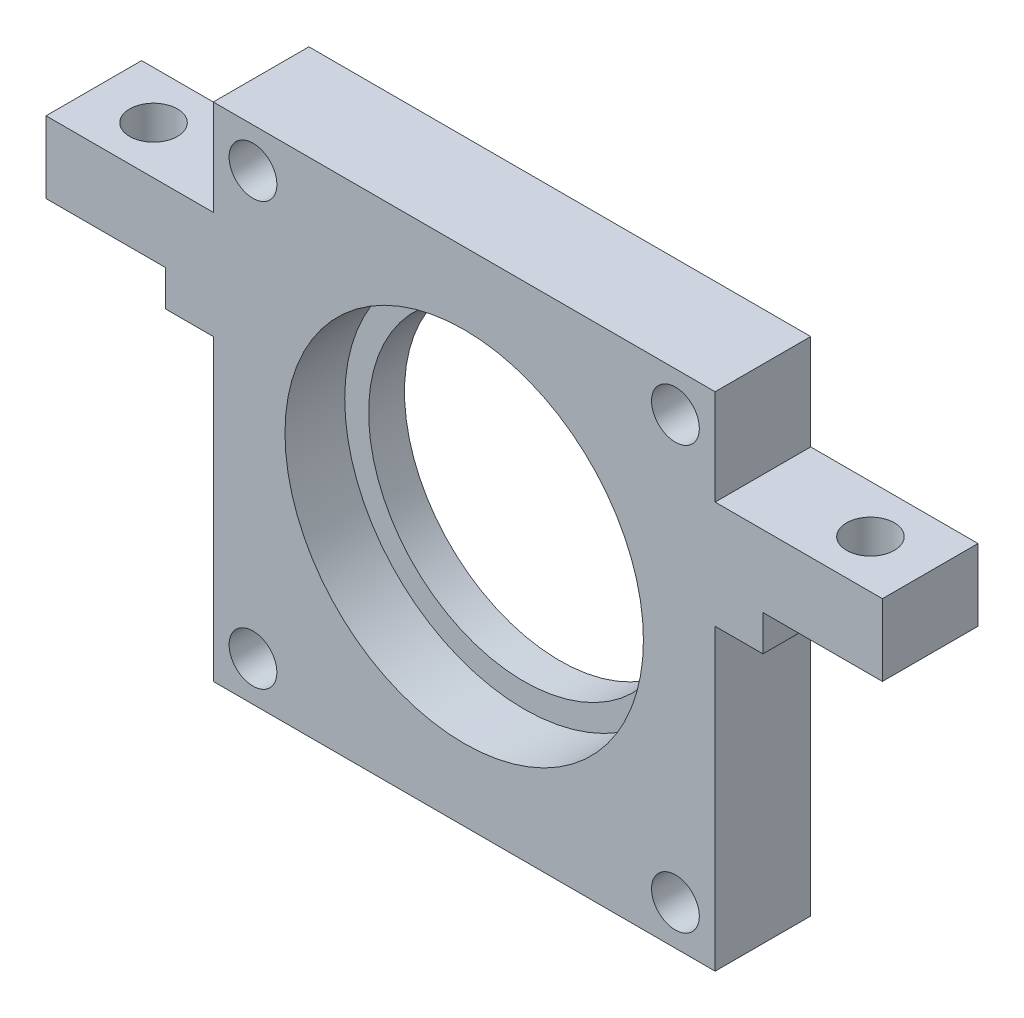
from build123d import *

# Parameters (mm, degrees)
EXTRUDE_1_DEPTH     = 4
SKETCH_3_R          = 15
CUT_EXTRUDE_1_DEPTH = 5
SKETCH_4_R          = 2
CUT_EXTRUDE_2_DEPTH = 42.593268686
SKETCH_5_R          = 2
CUT_EXTRUDE_3_DEPTH = 49.95916666
SKETCH_6_R          = 13
CUT_EXTRUDE_4_DEPTH = 42.12177039


with BuildPart() as part:
    # 草图2 → 凸台-拉伸1 (new, symmetric)
    with BuildSketch(Plane.XY):
        Polygon((-25, 7), (-35, 7), (-35, 13), (-21, 13), (-21, 21), (21, 21), (21, 13), (35, 13), (35, 7), (25, 7), (25, 4), (21, 4), (21, -21), (-21, -21), (-21, 4), (-25, 4), align=None)
    extrude(amount=EXTRUDE_1_DEPTH, both=True)

    # 草图3 → 切除-拉伸1 (cut)
    with BuildSketch(Plane.XY.offset(4)):
        Circle(SKETCH_3_R)
    extrude(amount=-CUT_EXTRUDE_1_DEPTH, mode=Mode.SUBTRACT)

    # 草图4 → 切除-拉伸2 (cut, through all)
    with BuildSketch(Plane.XY.offset(4)):
        with Locations((-17.67766953, 17.67766953)):
            Circle(SKETCH_4_R)
        with Locations((17.67766953, 17.67766953)):
            Circle(SKETCH_4_R)
        with Locations((17.67766953, -17.67766953)):
            Circle(SKETCH_4_R)
        with Locations((-17.67766953, -17.67766953)):
            Circle(SKETCH_4_R)
    extrude(amount=-CUT_EXTRUDE_2_DEPTH, mode=Mode.SUBTRACT)

    # 草图5 → 切除-拉伸3 (cut, through all)
    with BuildSketch(Plane(origin=(0, 13, 0), x_dir=(1, 0, 0), z_dir=(0, 1, 0))):
        with Locations(Location((-30, 0, 0), (0, 0, 180))):
            Circle(SKETCH_5_R)
        with Locations(Location((30, 0, 0), (0, 0, 180))):
            Circle(SKETCH_5_R)
    extrude(amount=-CUT_EXTRUDE_3_DEPTH, mode=Mode.SUBTRACT)

    # 草图6 → 切除-拉伸4 (cut, through all)
    with BuildSketch(Plane.XY.offset(-1)):
        Circle(SKETCH_6_R)
    extrude(amount=-CUT_EXTRUDE_4_DEPTH, mode=Mode.SUBTRACT)


solid = part.part
